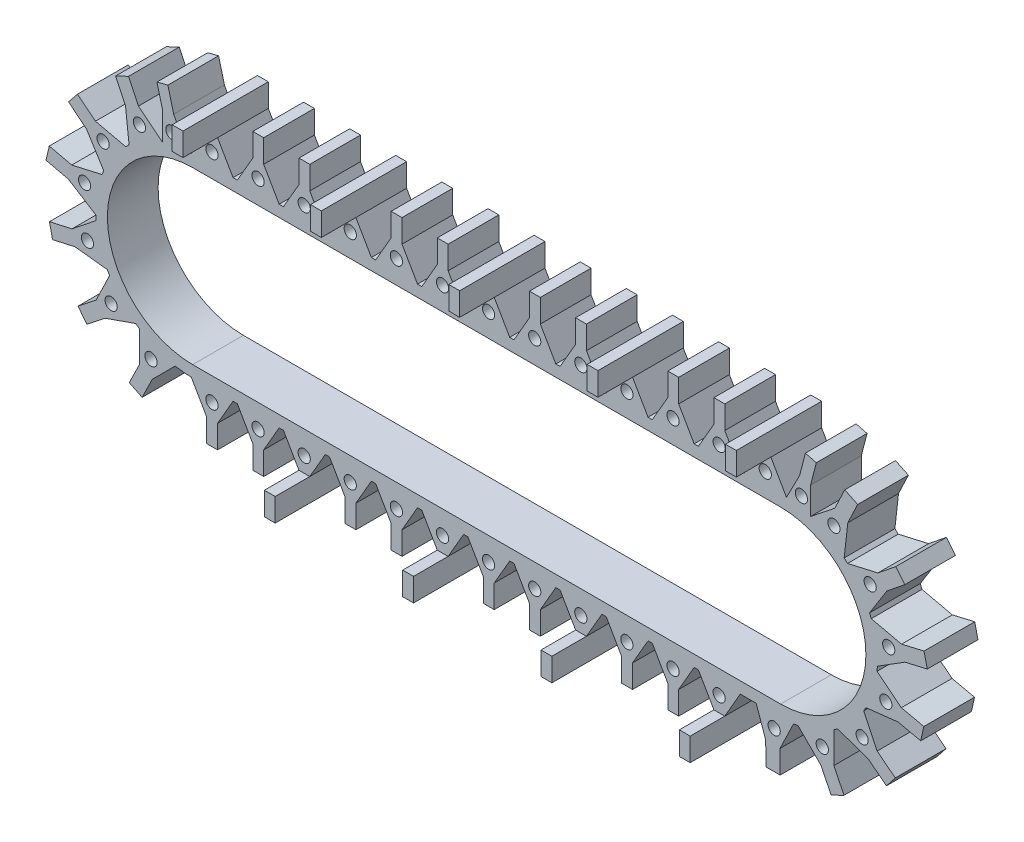
from build123d import *

# Parameters (mm, degrees)
SKETCH1_R                        = 5.304855617
BOSS_EXTRUDE1_DEPTH              = 44
SKIZZE1_W                        = 9.41415406
SKIZZE1_H                        = 44
AUFSATZ_LINEAR_AUSTRAGEN1_DEPTH  = 20
SKIZZE2_W                        = 9.41415406
SKIZZE2_H                        = 44
AUFSATZ_LINEAR_AUSTRAGEN2_DEPTH  = 20
SKIZZE3_W                        = 9.41415406
SKIZZE3_H                        = 44
AUFSATZ_LINEAR_AUSTRAGEN3_DEPTH  = 20
SKIZZE4_W                        = 9.41415406
SKIZZE4_H                        = 44
AUFSATZ_LINEAR_AUSTRAGEN4_DEPTH  = 20
SKIZZE5_W                        = 9.41415406
SKIZZE5_H                        = 44
AUFSATZ_LINEAR_AUSTRAGEN5_DEPTH  = 20
SKIZZE6_W                        = 9.41415406
SKIZZE6_H                        = 44
AUFSATZ_LINEAR_AUSTRAGEN6_DEPTH  = 20
SKIZZE7_W                        = 9.41415406
SKIZZE7_H                        = 44
AUFSATZ_LINEAR_AUSTRAGEN7_DEPTH  = 20
SKIZZE8_W                        = 9.41415406
SKIZZE8_H                        = 44
AUFSATZ_LINEAR_AUSTRAGEN8_DEPTH  = 20
SKIZZE9_W                        = 9.41415406
SKIZZE9_H                        = 44
AUFSATZ_LINEAR_AUSTRAGEN9_DEPTH  = 20
SKIZZE10_W                       = 9.41415406
SKIZZE10_H                       = 44
AUFSATZ_LINEAR_AUSTRAGEN10_DEPTH = 20
SKIZZE11_W                       = 9.41415406
SKIZZE11_H                       = 44
AUFSATZ_LINEAR_AUSTRAGEN11_DEPTH = 20
SKIZZE12_W                       = 9.803304207
SKIZZE12_H                       = 44
AUFSATZ_LINEAR_AUSTRAGEN12_DEPTH = 20
SKIZZE13_W                       = 12.432660884
SKIZZE13_H                       = 44
AUFSATZ_LINEAR_AUSTRAGEN13_DEPTH = 20
SKIZZE14_W                       = 44
SKIZZE14_H                       = 12.432660884
AUFSATZ_LINEAR_AUSTRAGEN14_DEPTH = 20
SKIZZE15_W                       = 44
SKIZZE15_H                       = 12.432660884
AUFSATZ_LINEAR_AUSTRAGEN15_DEPTH = 20
SKIZZE16_W                       = 44
SKIZZE16_H                       = 12.432660884
AUFSATZ_LINEAR_AUSTRAGEN16_DEPTH = 20
SKIZZE17_W                       = 44
SKIZZE17_H                       = 12.432660883
AUFSATZ_LINEAR_AUSTRAGEN17_DEPTH = 20
SKIZZE18_W                       = 12.432660884
SKIZZE18_H                       = 44
AUFSATZ_LINEAR_AUSTRAGEN18_DEPTH = 20
SKIZZE19_W                       = 9.41415406
SKIZZE19_H                       = 44
AUFSATZ_LINEAR_AUSTRAGEN19_DEPTH = 20
SKIZZE20_W                       = 9.41415406
SKIZZE20_H                       = 44
AUFSATZ_LINEAR_AUSTRAGEN20_DEPTH = 20
SKIZZE21_W                       = 9.41415406
SKIZZE21_H                       = 44
AUFSATZ_LINEAR_AUSTRAGEN21_DEPTH = 20
SKIZZE22_W                       = 9.41415406
SKIZZE22_H                       = 44
AUFSATZ_LINEAR_AUSTRAGEN22_DEPTH = 20
SKIZZE23_W                       = 9.41415406
SKIZZE23_H                       = 44
AUFSATZ_LINEAR_AUSTRAGEN23_DEPTH = 20
SKIZZE24_W                       = 9.41415406
SKIZZE24_H                       = 44
AUFSATZ_LINEAR_AUSTRAGEN24_DEPTH = 20
SKIZZE25_W                       = 9.41415406
SKIZZE25_H                       = 44
AUFSATZ_LINEAR_AUSTRAGEN25_DEPTH = 20
SKIZZE26_W                       = 9.41415406
SKIZZE26_H                       = 44
AUFSATZ_LINEAR_AUSTRAGEN26_DEPTH = 20
SKIZZE27_W                       = 9.41415406
SKIZZE27_H                       = 44
AUFSATZ_LINEAR_AUSTRAGEN27_DEPTH = 20
SKIZZE28_W                       = 9.41415406
SKIZZE28_H                       = 44
AUFSATZ_LINEAR_AUSTRAGEN28_DEPTH = 20
SKIZZE29_W                       = 9.41415406
SKIZZE29_H                       = 44
AUFSATZ_LINEAR_AUSTRAGEN29_DEPTH = 20
SKIZZE30_W                       = 9.41415406
SKIZZE30_H                       = 44
AUFSATZ_LINEAR_AUSTRAGEN30_DEPTH = 20
SKIZZE31_W                       = 12.432660883
SKIZZE31_H                       = 44
AUFSATZ_LINEAR_AUSTRAGEN31_DEPTH = 20
SKIZZE32_W                       = 12.432660883
SKIZZE32_H                       = 44
AUFSATZ_LINEAR_AUSTRAGEN32_DEPTH = 20
SKIZZE33_W                       = 44
SKIZZE33_H                       = 12.432660883
AUFSATZ_LINEAR_AUSTRAGEN33_DEPTH = 20
SKIZZE34_W                       = 44
SKIZZE34_H                       = 12.432660883
AUFSATZ_LINEAR_AUSTRAGEN34_DEPTH = 20
SKIZZE35_W                       = 44
SKIZZE35_H                       = 12.432660884
AUFSATZ_LINEAR_AUSTRAGEN35_DEPTH = 20
SKIZZE36_W                       = 44
SKIZZE36_H                       = 12.432660883
AUFSATZ_LINEAR_AUSTRAGEN36_DEPTH = 20
SKIZZE37_W                       = 12.432660883
SKIZZE37_H                       = 44
AUFSATZ_LINEAR_AUSTRAGEN37_DEPTH = 20
SKIZZE38_W                       = 9.803304207
SKIZZE38_H                       = 44
AUFSATZ_LINEAR_AUSTRAGEN38_DEPTH = 20
SKIZZE39_W                       = 9.41415406
SKIZZE39_H                       = 44
AUFSATZ_LINEAR_AUSTRAGEN39_DEPTH = 20
SKIZZE40_W                       = 9.41415406
SKIZZE40_H                       = 44
AUFSATZ_LINEAR_AUSTRAGEN40_DEPTH = 20
SKIZZE41_W                       = 9.41415406
SKIZZE41_H                       = 20
AUFSATZ_LINEAR_AUSTRAGEN41_DEPTH = 30


with BuildPart() as part:
    # Sketch1 → Boss-Extrude1 (new body)
    with BuildSketch(Plane.XY):
        with BuildLine():
            Line((-368.279008081, 208.137347398), (-377.693162141, 208.137347398))
            Line((-377.693162141, 208.137347398), (-391.140624551, 184.84565927))
            ThreePointArc((-391.140624551, 184.84565927), (-393.055558066, 184.794572872), (-394.968828688, 184.699832656))
            Line((-394.968828688, 184.699832656), (-406.364309987, 206.757674175))
            Line((-406.364309987, 206.757674175), (-415.856306602, 204.306802161))
            Line((-415.856306602, 204.306802161), (-415.856306602, 180.730933767))
            Line((-415.856306602, 180.730933767), (-436.937315979, 197.542477756))
            Line((-436.937315979, 197.542477756), (-448.168387597, 192.210115525))
            Line((-448.168387597, 192.210115525), (-445.013595724, 164.210563225))
            ThreePointArc((-445.013595724, 164.210563225), (-446.491708161, 162.892805497), (-447.938347028, 161.540571127))
            Line((-447.938347028, 161.540571127), (-474.225935747, 167.540541709))
            Line((-474.225935747, 167.540541709), (-482.031156365, 157.863269999))
            Line((-482.031156365, 157.863269999), (-467.040236656, 134.005357956))
            ThreePointArc((-467.040236656, 134.005357956), (-467.800216295, 132.176770316), (-468.516880373, 130.330776165))
            Line((-468.516880373, 130.330776165), (-494.804469092, 124.330805583))
            Line((-494.804469092, 124.330805583), (-497.637919041, 112.225326739))
            Line((-497.637919041, 112.225326739), (-473.780006998, 97.234407031))
            ThreePointArc((-473.780006998, 97.234407031), (-473.671330551, 95.257163688), (-473.516075729, 93.283031538))
            Line((-473.516075729, 93.283031538), (-494.597085106, 76.471487549))
            Line((-494.597085106, 76.471487549), (-491.897564874, 64.335440122))
            Line((-491.897564874, 64.335440122), (-463.898012575, 61.180648248))
            ThreePointArc((-463.898012575, 61.180648248), (-462.942204744, 59.446366495), (-461.945781144, 57.73509743))
            Line((-461.945781144, 57.73509743), (-473.644858731, 33.441712501))
            Line((-473.644858731, 33.441712501), (-465.947041408, 23.678789521))
            Line((-465.947041408, 23.678789521), (-439.351503576, 32.984970704))
            ThreePointArc((-439.351503576, 32.984970704), (-437.737873826, 31.837146312), (-436.097635362, 30.727678157))
            Line((-436.097635362, 30.727678157), (-436.097635362, 3.764055113))
            Line((-436.097635362, 3.764055113), (-424.926168076, -1.692076789))
            Line((-424.926168076, -1.692076789), (-405.002217154, 18.231874134))
            ThreePointArc((-405.002217154, 18.231874134), (-398.099796392, 17.260748368), (-391.140624551, 16.865242473))
            Line((-391.140624551, 16.865242473), (-377.693162141, -6.426445656))
            Line((-377.693162141, -6.426445656), (-368.279008081, -6.426445656))
            Line((-368.279008081, -6.426445656), (-354.837198854, 16.855450871))
            Line((-354.837198854, 16.855450871), (-351.134971368, 16.855450871))
            Line((-351.134971368, 16.855450871), (-337.693162141, -6.426445656))
            Line((-337.693162141, -6.426445656), (-328.279008081, -6.426445656))
            Line((-328.279008081, -6.426445656), (-314.837198854, 16.855450871))
            Line((-314.837198854, 16.855450871), (-311.134971368, 16.855450871))
            Line((-311.134971368, 16.855450871), (-297.693162141, -6.426445656))
            Line((-297.693162141, -6.426445656), (-288.279008081, -6.426445656))
            Line((-288.279008081, -6.426445656), (-274.837198854, 16.855450871))
            Line((-274.837198854, 16.855450871), (-271.134971368, 16.855450871))
            Line((-271.134971368, 16.855450871), (-257.693162141, -6.426445656))
            Line((-257.693162141, -6.426445656), (-248.279008081, -6.426445656))
            Line((-248.279008081, -6.426445656), (-234.837198854, 16.855450871))
            Line((-234.837198854, 16.855450871), (-231.134971368, 16.855450871))
            Line((-231.134971368, 16.855450871), (-217.693162141, -6.426445656))
            Line((-217.693162141, -6.426445656), (-208.279008081, -6.426445656))
            Line((-208.279008081, -6.426445656), (-194.837198854, 16.855450871))
            Line((-194.837198854, 16.855450871), (-191.134971368, 16.855450871))
            Line((-191.134971368, 16.855450871), (-177.693162141, -6.426445656))
            Line((-177.693162141, -6.426445656), (-168.279008081, -6.426445656))
            Line((-168.279008081, -6.426445656), (-154.837198854, 16.855450871))
            Line((-154.837198854, 16.855450871), (-151.134971368, 16.855450871))
            Line((-151.134971368, 16.855450871), (-137.693162141, -6.426445656))
            Line((-137.693162141, -6.426445656), (-128.279008081, -6.426445656))
            Line((-128.279008081, -6.426445656), (-114.837198854, 16.855450871))
            Line((-114.837198854, 16.855450871), (-111.134971368, 16.855450871))
            Line((-111.134971368, 16.855450871), (-97.693162141, -6.426445656))
            Line((-97.693162141, -6.426445656), (-88.279008081, -6.426445656))
            Line((-88.279008081, -6.426445656), (-74.837198854, 16.855450871))
            Line((-74.837198854, 16.855450871), (-71.134971368, 16.855450871))
            Line((-71.134971368, 16.855450871), (-57.693162141, -6.426445656))
            Line((-57.693162141, -6.426445656), (-48.279008081, -6.426445656))
            Line((-48.279008081, -6.426445656), (-34.837198854, 16.855450871))
            Line((-34.837198854, 16.855450871), (-31.134971368, 16.855450871))
            Line((-31.134971368, 16.855450871), (-17.693162141, -6.426445656))
            Line((-17.693162141, -6.426445656), (-8.279008081, -6.426445656))
            Line((-8.279008081, -6.426445656), (5.162801146, 16.855450871))
            Line((5.162801146, 16.855450871), (8.865028632, 16.855450871))
            Line((8.865028632, 16.855450871), (22.306837859, -6.426445656))
            Line((22.306837859, -6.426445656), (31.720991919, -6.426445656))
            Line((31.720991919, -6.426445656), (45.162801146, 16.855450871))
            Line((45.162801146, 16.855450871), (48.865028632, 16.855450871))
            Line((48.865028632, 16.855450871), (62.306837859, -6.426445656))
            Line((62.306837859, -6.426445656), (71.720991919, -6.426445656))
            Line((71.720991919, -6.426445656), (85.162801146, 16.855450871))
            Line((85.162801146, 16.855450871), (88.865028632, 16.855450871))
            Line((88.865028632, 16.855450871), (88.971712538, 16.855450871))
            Line((88.971712538, 16.855450871), (98.982794632, 16.855450871))
            Line((98.982794632, 16.855450871), (107.129482574, -6.426445656))
            Line((107.129482574, -6.426445656), (107.243450607, -6.752147583))
            Line((107.243450607, -6.752147583), (119.675921751, -6.683460598))
            Line((119.675921751, -6.683460598), (131.374999338, 17.60992433))
            ThreePointArc((131.374999338, 17.60992433), (133.334183321, 17.897847801), (135.28603583, 18.231874134))
            Line((135.28603583, 18.231874134), (155.209986752, -1.692076789))
            Line((155.209986752, -1.692076789), (166.381454038, 3.764055113))
            Line((166.381454038, 3.764055113), (166.381454038, 30.727678157))
            ThreePointArc((166.381454038, 30.727678157), (168.021692502, 31.837146312), (169.635322252, 32.984970704))
            Line((169.635322252, 32.984970704), (196.230860084, 23.678789521))
            Line((196.230860084, 23.678789521), (203.928677407, 33.441712501))
            Line((203.928677407, 33.441712501), (192.22959982, 57.73509743))
            ThreePointArc((192.22959982, 57.73509743), (193.22602342, 59.446366495), (194.181831251, 61.180648248))
            Line((194.181831251, 61.180648248), (222.18138355, 64.335440122))
            Line((222.18138355, 64.335440122), (224.880903782, 76.471487549))
            Line((224.880903782, 76.471487549), (203.799894405, 93.283031538))
            ThreePointArc((203.799894405, 93.283031538), (203.955149227, 95.257163688), (204.063825674, 97.234407031))
            Line((204.063825674, 97.234407031), (227.921737717, 112.225326739))
            Line((227.921737717, 112.225326739), (225.088287768, 124.330805583))
            Line((225.088287768, 124.330805583), (198.800699049, 130.330776165))
            ThreePointArc((198.800699049, 130.330776165), (198.084034971, 132.176770316), (197.324055332, 134.005357956))
            Line((197.324055332, 134.005357956), (212.314975041, 157.863269999))
            Line((212.314975041, 157.863269999), (204.509754423, 167.540541709))
            Line((204.509754423, 167.540541709), (178.222165704, 161.540571127))
            ThreePointArc((178.222165704, 161.540571127), (176.775526837, 162.892805497), (175.2974144, 164.210563225))
            Line((175.2974144, 164.210563225), (178.452206273, 192.210115525))
            Line((178.452206273, 192.210115525), (167.221134655, 197.542477756))
            Line((167.221134655, 197.542477756), (146.140125278, 180.730933767))
            Line((146.140125278, 180.730933767), (146.140125278, 204.306802161))
            Line((146.140125278, 204.306802161), (136.648128663, 206.757674175))
            Line((136.648128663, 206.757674175), (125.252647364, 184.699832656))
            Line((125.252647364, 184.699832656), (111.720991919, 208.137347398))
            Line((111.720991919, 208.137347398), (102.306837859, 208.137347398))
            Line((102.306837859, 208.137347398), (88.865028632, 184.855450871))
            Line((88.865028632, 184.855450871), (85.162801146, 184.855450871))
            Line((85.162801146, 184.855450871), (76.790181677, 199.357253183))
            Line((76.790181677, 199.357253183), (71.720991919, 208.137347398))
            Line((71.720991919, 208.137347398), (62.306837859, 208.137347398))
            Line((62.306837859, 208.137347398), (48.865028632, 184.855450871))
            Line((48.865028632, 184.855450871), (45.162801146, 184.855450871))
            Line((45.162801146, 184.855450871), (31.720991919, 208.137347398))
            Line((31.720991919, 208.137347398), (22.306837859, 208.137347398))
            Line((22.306837859, 208.137347398), (8.865028632, 184.855450871))
            Line((8.865028632, 184.855450871), (5.162801146, 184.855450871))
            Line((5.162801146, 184.855450871), (-8.279008081, 208.137347398))
            Line((-8.279008081, 208.137347398), (-17.693162141, 208.137347398))
            Line((-17.693162141, 208.137347398), (-31.134971368, 184.855450871))
            Line((-31.134971368, 184.855450871), (-34.837198854, 184.855450871))
            Line((-34.837198854, 184.855450871), (-48.279008081, 208.137347398))
            Line((-48.279008081, 208.137347398), (-57.693162141, 208.137347398))
            Line((-57.693162141, 208.137347398), (-71.134971368, 184.855450871))
            Line((-71.134971368, 184.855450871), (-74.837198854, 184.855450871))
            Line((-74.837198854, 184.855450871), (-88.279008081, 208.137347398))
            Line((-88.279008081, 208.137347398), (-97.693162141, 208.137347398))
            Line((-97.693162141, 208.137347398), (-111.134971368, 184.855450871))
            Line((-111.134971368, 184.855450871), (-114.837198854, 184.855450871))
            Line((-114.837198854, 184.855450871), (-128.279008081, 208.137347398))
            Line((-128.279008081, 208.137347398), (-137.693162141, 208.137347398))
            Line((-137.693162141, 208.137347398), (-151.134971368, 184.855450871))
            Line((-151.134971368, 184.855450871), (-154.837198854, 184.855450871))
            Line((-154.837198854, 184.855450871), (-168.279008081, 208.137347398))
            Line((-168.279008081, 208.137347398), (-177.693162141, 208.137347398))
            Line((-177.693162141, 208.137347398), (-191.134971368, 184.855450871))
            Line((-191.134971368, 184.855450871), (-194.837198854, 184.855450871))
            Line((-194.837198854, 184.855450871), (-208.279008081, 208.137347398))
            Line((-208.279008081, 208.137347398), (-217.693162141, 208.137347398))
            Line((-217.693162141, 208.137347398), (-231.134971368, 184.855450871))
            Line((-231.134971368, 184.855450871), (-234.837198854, 184.855450871))
            Line((-234.837198854, 184.855450871), (-248.279008081, 208.137347398))
            Line((-248.279008081, 208.137347398), (-257.693162141, 208.137347398))
            Line((-257.693162141, 208.137347398), (-271.134971368, 184.855450871))
            Line((-271.134971368, 184.855450871), (-274.837198854, 184.855450871))
            Line((-274.837198854, 184.855450871), (-288.279008081, 208.137347398))
            Line((-288.279008081, 208.137347398), (-297.693162141, 208.137347398))
            Line((-297.693162141, 208.137347398), (-311.134971368, 184.855450871))
            Line((-311.134971368, 184.855450871), (-314.837198854, 184.855450871))
            Line((-314.837198854, 184.855450871), (-328.279008081, 208.137347398))
            Line((-328.279008081, 208.137347398), (-337.693162141, 208.137347398))
            Line((-337.693162141, 208.137347398), (-351.134971368, 184.855450871))
            Line((-351.134971368, 184.855450871), (-354.837198854, 184.855450871))
            Line((-354.837198854, 184.855450871), (-368.279008081, 208.137347398))
        make_face()
        with Locations((-426.021067812, 12.909443776)):
            Circle(SKETCH1_R, mode=Mode.SUBTRACT)
        with Locations((-373.153370384, 6.777668426)):
            Circle(SKETCH1_R, mode=Mode.SUBTRACT)
        with Locations((-333.153370384, 6.777668426)):
            Circle(SKETCH1_R, mode=Mode.SUBTRACT)
        with Locations((-460.598149643, 37.309364166)):
            Circle(SKETCH1_R, mode=Mode.SUBTRACT)
        with Locations((-293.153370384, 6.777668426)):
            Circle(SKETCH1_R, mode=Mode.SUBTRACT)
        with Locations((-253.153370384, 6.777668426)):
            Circle(SKETCH1_R, mode=Mode.SUBTRACT)
        with Locations((-213.153370384, 6.777668426)):
            Circle(SKETCH1_R, mode=Mode.SUBTRACT)
        with Locations((-173.153370384, 6.777668426)):
            Circle(SKETCH1_R, mode=Mode.SUBTRACT)
        with Locations((-481.164295224, 74.295366369)):
            Circle(SKETCH1_R, mode=Mode.SUBTRACT)
        with Locations((-133.153370384, 6.777668426)):
            Circle(SKETCH1_R, mode=Mode.SUBTRACT)
        with Locations((-93.153370384, 6.777668426)):
            Circle(SKETCH1_R, mode=Mode.SUBTRACT)
        with Locations((-53.153370384, 6.777668426)):
            Circle(SKETCH1_R, mode=Mode.SUBTRACT)
        with Locations((-13.153370384, 6.777668426)):
            Circle(SKETCH1_R, mode=Mode.SUBTRACT)
        with Locations((26.846629616, 6.777668426)):
            Circle(SKETCH1_R, mode=Mode.SUBTRACT)
        with Locations((66.846629616, 6.777668426)):
            Circle(SKETCH1_R, mode=Mode.SUBTRACT)
        with Locations((156.304886488, 12.909443776)):
            Circle(SKETCH1_R, mode=Mode.SUBTRACT)
        with Locations((190.881968319, 37.309364166)):
            Circle(SKETCH1_R, mode=Mode.SUBTRACT)
        with Locations((211.4481139, 74.295366369)):
            Circle(SKETCH1_R, mode=Mode.SUBTRACT)
        with Locations((-483.646127194, 116.541919046)):
            Circle(SKETCH1_R, mode=Mode.SUBTRACT)
        with Locations((-467.552088294, 155.681574319)):
            Circle(SKETCH1_R, mode=Mode.SUBTRACT)
        with Locations((-436.069800308, 183.962243445)):
            Circle(SKETCH1_R, mode=Mode.SUBTRACT)
        with Locations((-407.896104995, 192.210115525)):
            Circle(SKETCH1_R, mode=Mode.SUBTRACT)
        with Locations((-373.153370384, 194.933233316)):
            Circle(SKETCH1_R, mode=Mode.SUBTRACT)
        with Locations((-333.153370384, 194.933233316)):
            Circle(SKETCH1_R, mode=Mode.SUBTRACT)
        with Locations((-293.153370384, 194.933233316)):
            Circle(SKETCH1_R, mode=Mode.SUBTRACT)
        with Locations((-253.153370384, 194.933233316)):
            Circle(SKETCH1_R, mode=Mode.SUBTRACT)
        with Locations((-213.153370384, 194.933233316)):
            Circle(SKETCH1_R, mode=Mode.SUBTRACT)
        with Locations((-173.153370384, 194.933233316)):
            Circle(SKETCH1_R, mode=Mode.SUBTRACT)
        with BuildLine():
            Line((-389.858090662, 174.855450871), (-134.858090662, 174.855450871))
            Line((-134.858090662, 174.855450871), (120.141909338, 174.855450871))
            ThreePointArc((120.141909338, 174.855450871), (194.141909338, 100.855450871), (120.141909338, 26.855450871))
            Line((120.141909338, 26.855450871), (-389.858090662, 26.855450871))
            ThreePointArc((-389.858090662, 26.855450871), (-463.858090662, 100.855450871), (-389.858090662, 174.855450871))
        make_face(mode=Mode.SUBTRACT)
        with Locations((213.92994587, 116.541919046)):
            Circle(SKETCH1_R, mode=Mode.SUBTRACT)
        with Locations((-133.153370384, 194.933233316)):
            Circle(SKETCH1_R, mode=Mode.SUBTRACT)
        with Locations((-93.153370384, 194.933233316)):
            Circle(SKETCH1_R, mode=Mode.SUBTRACT)
        with Locations((-53.153370384, 194.933233316)):
            Circle(SKETCH1_R, mode=Mode.SUBTRACT)
        with Locations((-13.153370384, 194.933233316)):
            Circle(SKETCH1_R, mode=Mode.SUBTRACT)
        with Locations((26.846629616, 194.933233316)):
            Circle(SKETCH1_R, mode=Mode.SUBTRACT)
        with Locations((197.83590697, 155.681574319)):
            Circle(SKETCH1_R, mode=Mode.SUBTRACT)
        with Locations((66.846629616, 194.933233316)):
            Circle(SKETCH1_R, mode=Mode.SUBTRACT)
        with Locations((106.846629616, 194.933233316)):
            Circle(SKETCH1_R, mode=Mode.SUBTRACT)
        with Locations((166.353618984, 183.962243445)):
            Circle(SKETCH1_R, mode=Mode.SUBTRACT)
        with Locations((138.179923671, 192.210115525)):
            Circle(SKETCH1_R, mode=Mode.SUBTRACT)
        with Locations((114.565283522, 5.928308679)):
            Circle(SKETCH1_R, mode=Mode.SUBTRACT)
    extrude(amount=BOSS_EXTRUDE1_DEPTH)

    # Skizze1 → Aufsatz-Linear austragen1 (add)
    with BuildSketch(Plane(origin=(0, 208.137347398, 0), x_dir=(1, 0, 0), z_dir=(0, 1, 0))):
        with Locations((27.013914889, -22)):
            Rectangle(SKIZZE1_W, SKIZZE1_H)
    extrude(amount=AUFSATZ_LINEAR_AUSTRAGEN1_DEPTH)

    # Skizze2 → Aufsatz-Linear austragen2 (add)
    with BuildSketch(Plane(origin=(0, 208.137347398, 0), x_dir=(1, 0, 0), z_dir=(0, 1, 0))):
        with Locations((-12.986085111, -22)):
            Rectangle(SKIZZE2_W, SKIZZE2_H)
    extrude(amount=AUFSATZ_LINEAR_AUSTRAGEN2_DEPTH)

    # Skizze3 → Aufsatz-Linear austragen3 (add)
    with BuildSketch(Plane(origin=(0, 208.137347398, 0), x_dir=(1, 0, 0), z_dir=(0, 1, 0))):
        with Locations((-52.986085111, -22)):
            Rectangle(SKIZZE3_W, SKIZZE3_H)
    extrude(amount=AUFSATZ_LINEAR_AUSTRAGEN3_DEPTH)

    # Skizze4 → Aufsatz-Linear austragen4 (add)
    with BuildSketch(Plane(origin=(0, 208.137347398, 0), x_dir=(1, 0, 0), z_dir=(0, 1, 0))):
        with Locations((-92.986085111, -22)):
            Rectangle(SKIZZE4_W, SKIZZE4_H)
    extrude(amount=AUFSATZ_LINEAR_AUSTRAGEN4_DEPTH)

    # Skizze5 → Aufsatz-Linear austragen5 (add)
    with BuildSketch(Plane(origin=(0, 208.137347398, 0), x_dir=(1, 0, 0), z_dir=(0, 1, 0))):
        with Locations((-132.986085111, -22)):
            Rectangle(SKIZZE5_W, SKIZZE5_H)
    extrude(amount=AUFSATZ_LINEAR_AUSTRAGEN5_DEPTH)

    # Skizze6 → Aufsatz-Linear austragen6 (add)
    with BuildSketch(Plane(origin=(0, 208.137347398, 0), x_dir=(1, 0, 0), z_dir=(0, 1, 0))):
        with Locations((-172.986085111, -22)):
            Rectangle(SKIZZE6_W, SKIZZE6_H)
    extrude(amount=AUFSATZ_LINEAR_AUSTRAGEN6_DEPTH)

    # Skizze7 → Aufsatz-Linear austragen7 (add)
    with BuildSketch(Plane(origin=(0, 208.137347398, 0), x_dir=(1, 0, 0), z_dir=(0, 1, 0))):
        with Locations((-212.986085111, -22)):
            Rectangle(SKIZZE7_W, SKIZZE7_H)
    extrude(amount=AUFSATZ_LINEAR_AUSTRAGEN7_DEPTH)

    # Skizze8 → Aufsatz-Linear austragen8 (add)
    with BuildSketch(Plane(origin=(0, 208.137347398, 0), x_dir=(1, 0, 0), z_dir=(0, 1, 0))):
        with Locations((-252.986085111, -22)):
            Rectangle(SKIZZE8_W, SKIZZE8_H)
    extrude(amount=AUFSATZ_LINEAR_AUSTRAGEN8_DEPTH)

    # Skizze9 → Aufsatz-Linear austragen9 (add)
    with BuildSketch(Plane(origin=(0, 208.137347398, 0), x_dir=(1, 0, 0), z_dir=(0, 1, 0))):
        with Locations((-292.986085111, -22)):
            Rectangle(SKIZZE9_W, SKIZZE9_H)
    extrude(amount=AUFSATZ_LINEAR_AUSTRAGEN9_DEPTH)

    # Skizze10 → Aufsatz-Linear austragen10 (add)
    with BuildSketch(Plane(origin=(0, 208.137347398, 0), x_dir=(1, 0, 0), z_dir=(0, 1, 0))):
        with Locations((-332.986085111, -22)):
            Rectangle(SKIZZE10_W, SKIZZE10_H)
    extrude(amount=AUFSATZ_LINEAR_AUSTRAGEN10_DEPTH)

    # Skizze11 → Aufsatz-Linear austragen11 (add)
    with BuildSketch(Plane(origin=(0, 208.137347398, 0), x_dir=(1, 0, 0), z_dir=(0, 1, 0))):
        with Locations((-372.986085111, -22)):
            Rectangle(SKIZZE11_W, SKIZZE11_H)
    extrude(amount=AUFSATZ_LINEAR_AUSTRAGEN11_DEPTH)

    # Skizze12 → Aufsatz-Linear austragen12 (add)
    with BuildSketch(Plane(origin=(-75.447662284, 292.201694384, 0), x_dir=(0.9682446260031685, 0.25000468838800677, 0), z_dir=(-0.25000468838800677, 0.9682446260031685, 0))):
        with Locations((-346.671323544, -22)):
            Rectangle(SKIZZE12_W, SKIZZE12_H)
    extrude(amount=AUFSATZ_LINEAR_AUSTRAGEN12_DEPTH)

    # Skizze13 → Aufsatz-Linear austragen13 (add)
    with BuildSketch(Plane(origin=(-156.91401837, 330.493785245, 0), x_dir=(0.903352204551377, 0.4288995156585833, 0), z_dir=(-0.4288995156585833, 0.903352204551377, 0))):
        with Locations((-316.198745051, -22)):
            Rectangle(SKIZZE13_W, SKIZZE13_H)
    extrude(amount=AUFSATZ_LINEAR_AUSTRAGEN13_DEPTH)

    # Skizze14 → Aufsatz-Linear austragen14 (add)
    with BuildSketch(Plane(origin=(-369.189062207, 297.770091225, 0), x_dir=(0, 0, 1), z_dir=(-0.778374943317651, 0.6277996874921519, 0))):
        with Locations((22, -173.525865048)):
            Rectangle(SKIZZE14_W, SKIZZE14_H)
    extrude(amount=AUFSATZ_LINEAR_AUSTRAGEN14_DEPTH)

    # Skizze15 → Aufsatz-Linear austragen15 (add)
    with BuildSketch(Plane(origin=(-496.694038224, 116.257912268, 0), x_dir=(0, 0, 1), z_dir=(-0.9736836673104443, 0.2279037428672114, 0))):
        with Locations((22, 2.074753804)):
            Rectangle(SKIZZE15_W, SKIZZE15_H)
    extrude(amount=AUFSATZ_LINEAR_AUSTRAGEN15_DEPTH)

    # Skizze16 → Aufsatz-Linear austragen16 (add)
    with BuildSketch(Plane(origin=(-455.07058717, -101.22507053, 0), x_dir=(0, 0, 1), z_dir=(-0.9761423995458788, -0.21713133308855742, 0))):
        with Locations((22, 175.823255342)):
            Rectangle(SKIZZE16_W, SKIZZE16_H)
    extrude(amount=AUFSATZ_LINEAR_AUSTRAGEN16_DEPTH)

    # Skizze17 → Aufsatz-Linear austragen17 (add)
    with BuildSketch(Plane(origin=(-275.808747039, -217.468206514, 0), x_dir=(0, 0, 1), z_dir=(-0.7852641579503548, -0.619160885585096, 0))):
        with Locations((22, 313.306617951)):
            Rectangle(SKIZZE17_W, SKIZZE17_H)
    extrude(amount=AUFSATZ_LINEAR_AUSTRAGEN17_DEPTH)

    # Skizze18 → Aufsatz-Linear austragen18 (add)
    with BuildSketch(Plane(origin=(-82.505250433, -168.930063051, 0), x_dir=(0.8985580311815659, -0.43885471923987357, 0), z_dir=(-0.4388547192398735, -0.8985580311815657, 0))):
        with Locations((-387.294575542, 22)):
            Rectangle(SKIZZE18_W, SKIZZE18_H)
    extrude(amount=AUFSATZ_LINEAR_AUSTRAGEN18_DEPTH)

    # Skizze19 → Aufsatz-Linear austragen19 (add)
    with BuildSketch(Plane.XZ.offset(6.426445656)):
        with Locations((-372.986085111, 22)):
            Rectangle(SKIZZE19_W, SKIZZE19_H)
    extrude(amount=AUFSATZ_LINEAR_AUSTRAGEN19_DEPTH)

    # Skizze20 → Aufsatz-Linear austragen20 (add)
    with BuildSketch(Plane.XZ.offset(6.426445656)):
        with Locations((-332.986085111, 22)):
            Rectangle(SKIZZE20_W, SKIZZE20_H)
    extrude(amount=AUFSATZ_LINEAR_AUSTRAGEN20_DEPTH)

    # Skizze21 → Aufsatz-Linear austragen21 (add)
    with BuildSketch(Plane.XZ.offset(6.426445656)):
        with Locations((-292.986085111, 22)):
            Rectangle(SKIZZE21_W, SKIZZE21_H)
    extrude(amount=AUFSATZ_LINEAR_AUSTRAGEN21_DEPTH)

    # Skizze22 → Aufsatz-Linear austragen22 (add)
    with BuildSketch(Plane.XZ.offset(6.426445656)):
        with Locations((-252.986085111, 22)):
            Rectangle(SKIZZE22_W, SKIZZE22_H)
    extrude(amount=AUFSATZ_LINEAR_AUSTRAGEN22_DEPTH)

    # Skizze23 → Aufsatz-Linear austragen23 (add)
    with BuildSketch(Plane.XZ.offset(6.426445656)):
        with Locations((-212.986085111, 22)):
            Rectangle(SKIZZE23_W, SKIZZE23_H)
    extrude(amount=AUFSATZ_LINEAR_AUSTRAGEN23_DEPTH)

    # Skizze24 → Aufsatz-Linear austragen24 (add)
    with BuildSketch(Plane.XZ.offset(6.426445656)):
        with Locations((-172.986085111, 22)):
            Rectangle(SKIZZE24_W, SKIZZE24_H)
    extrude(amount=AUFSATZ_LINEAR_AUSTRAGEN24_DEPTH)

    # Skizze25 → Aufsatz-Linear austragen25 (add)
    with BuildSketch(Plane.XZ.offset(6.426445656)):
        with Locations((-132.986085111, 22)):
            Rectangle(SKIZZE25_W, SKIZZE25_H)
    extrude(amount=AUFSATZ_LINEAR_AUSTRAGEN25_DEPTH)

    # Skizze26 → Aufsatz-Linear austragen26 (add)
    with BuildSketch(Plane.XZ.offset(6.426445656)):
        with Locations((-92.986085111, 22)):
            Rectangle(SKIZZE26_W, SKIZZE26_H)
    extrude(amount=AUFSATZ_LINEAR_AUSTRAGEN26_DEPTH)

    # Skizze27 → Aufsatz-Linear austragen27 (add)
    with BuildSketch(Plane.XZ.offset(6.426445656)):
        with Locations((-52.986085111, 22)):
            Rectangle(SKIZZE27_W, SKIZZE27_H)
    extrude(amount=AUFSATZ_LINEAR_AUSTRAGEN27_DEPTH)

    # Skizze28 → Aufsatz-Linear austragen28 (add)
    with BuildSketch(Plane.XZ.offset(6.426445656)):
        with Locations((-12.986085111, 22)):
            Rectangle(SKIZZE28_W, SKIZZE28_H)
    extrude(amount=AUFSATZ_LINEAR_AUSTRAGEN28_DEPTH)

    # Skizze29 → Aufsatz-Linear austragen29 (add)
    with BuildSketch(Plane.XZ.offset(6.426445656)):
        with Locations((27.013914889, 22)):
            Rectangle(SKIZZE29_W, SKIZZE29_H)
    extrude(amount=AUFSATZ_LINEAR_AUSTRAGEN29_DEPTH)

    # Skizze30 → Aufsatz-Linear austragen30 (add)
    with BuildSketch(Plane.XZ.offset(6.426445656)):
        with Locations((67.013914889, 22)):
            Rectangle(SKIZZE30_W, SKIZZE30_H)
    extrude(amount=AUFSATZ_LINEAR_AUSTRAGEN30_DEPTH)

    # Skizze31 → Aufsatz-Linear austragen31 (add)
    with BuildSketch(Plane(origin=(0.040576506, -7.344422612, 0), x_dir=(0.9999847386114645, 0.00552472118401051, 0), z_dir=(0.00552472118401051, -0.9999847386114645, 0))):
        with Locations((113.420840633, 22)):
            Rectangle(SKIZZE31_W, SKIZZE31_H)
    extrude(amount=AUFSATZ_LINEAR_AUSTRAGEN31_DEPTH)

    # Skizze32 → Aufsatz-Linear austragen32 (add)
    with BuildSketch(Plane(origin=(30.559676613, -62.571146321, 0), x_dir=(0.8985580311815659, 0.43885471923987357, 0), z_dir=(0.4388547192398735, -0.8985580311815657, 0))):
        with Locations((144.938934674, 22)):
            Rectangle(SKIZZE32_W, SKIZZE32_H)
    extrude(amount=AUFSATZ_LINEAR_AUSTRAGEN32_DEPTH)

    # Skizze33 → Aufsatz-Linear austragen33 (add)
    with BuildSketch(Plane(origin=(109.491015535, -86.330890638, 0), x_dir=(0, 0, -1), z_dir=(0.7852641579503548, -0.619160885585096, 0))):
        with Locations((-22, 146.308908266)):
            Rectangle(SKIZZE33_W, SKIZZE33_H)
    extrude(amount=AUFSATZ_LINEAR_AUSTRAGEN33_DEPTH)

    # Skizze34 → Aufsatz-Linear austragen34 (add)
    with BuildSketch(Plane(origin=(198.070449194, -44.058429077, 0), x_dir=(0, 0, -1), z_dir=(0.9761423995458783, -0.21713133308855892, 0))):
        with Locations((-22, 117.259421336)):
            Rectangle(SKIZZE34_W, SKIZZE34_H)
    extrude(amount=AUFSATZ_LINEAR_AUSTRAGEN34_DEPTH)

    # Skizze35 → Aufsatz-Linear austragen35 (add)
    with BuildSketch(Plane(origin=(240.986946649, 56.406232298, 0), x_dir=(0, 0, -1), z_dir=(0.973683667310444, 0.22790374286721302, 0))):
        with Locations((-22, 63.54408104)):
            Rectangle(SKIZZE35_W, SKIZZE35_H)
    extrude(amount=AUFSATZ_LINEAR_AUSTRAGEN35_DEPTH)

    # Skizze36 → Aufsatz-Linear austragen36 (add)
    with BuildSketch(Plane(origin=(205.77677959, 165.969625601, 0), x_dir=(0, 0, -1), z_dir=(0.7783749433176502, 0.6277996874921529, 0))):
        with Locations((-22, -4.198130702)):
            Rectangle(SKIZZE36_W, SKIZZE36_H)
    extrude(amount=AUFSATZ_LINEAR_AUSTRAGEN36_DEPTH)

    # Skizze37 → Aufsatz-Linear austragen37 (add)
    with BuildSketch(Plane(origin=(107.298433653, 225.992972821, 0), x_dir=(0.9033522045513767, -0.4288995156585839, 0), z_dir=(0.4288995156585839, 0.9033522045513767, 0))):
        with Locations((72.550038048, -22)):
            Rectangle(SKIZZE37_W, SKIZZE37_H)
    extrude(amount=AUFSATZ_LINEAR_AUSTRAGEN37_DEPTH)

    # Skizze38 → Aufsatz-Linear austragen38 (add)
    with BuildSketch(Plane(origin=(58.589768678, 226.912659227, 0), x_dir=(0.9682446260031683, -0.25000468838800755, 0), z_dir=(0.25000468838800755, 0.9682446260031684, 0))):
        with Locations((85.520080431, -22)):
            Rectangle(SKIZZE38_W, SKIZZE38_H)
    extrude(amount=AUFSATZ_LINEAR_AUSTRAGEN38_DEPTH)

    # Skizze39 → Aufsatz-Linear austragen39 (add)
    with BuildSketch(Plane(origin=(0, 208.137347398, 0), x_dir=(1, 0, 0), z_dir=(0, 1, 0))):
        with Locations((107.013914889, -22)):
            Rectangle(SKIZZE39_W, SKIZZE39_H)
    extrude(amount=AUFSATZ_LINEAR_AUSTRAGEN39_DEPTH)

    # Skizze40 → Aufsatz-Linear austragen40 (add)
    with BuildSketch(Plane(origin=(0, 208.137347398, 0), x_dir=(1, 0, 0), z_dir=(0, 1, 0))):
        with Locations((67.013914889, -22)):
            Rectangle(SKIZZE40_W, SKIZZE40_H)
    extrude(amount=AUFSATZ_LINEAR_AUSTRAGEN40_DEPTH)

    # Skizze41 → Aufsatz-Linear austragen41 (add)
    with BuildSketch(Plane.XY.offset(44)):
        with Locations((-372.986085111, 218.137347398)):
            Rectangle(SKIZZE41_W, SKIZZE41_H)
        with Locations((-252.986085111, 218.137347398)):
            Rectangle(SKIZZE41_W, SKIZZE41_H)
        with Locations((-132.986085111, 218.137347398)):
            Rectangle(SKIZZE41_W, SKIZZE41_H)
        with Locations((-12.986085111, 218.137347398)):
            Rectangle(SKIZZE41_W, SKIZZE41_H)
        with Locations((107.013914889, 218.137347398)):
            Rectangle(SKIZZE41_W, SKIZZE41_H)
        with Locations((67.013914889, -16.426445656)):
            Rectangle(SKIZZE41_W, SKIZZE41_H)
        with Locations((-52.986085111, -16.426445656)):
            Rectangle(SKIZZE41_W, SKIZZE41_H)
        with Locations((-172.986085111, -16.426445656)):
            Rectangle(SKIZZE41_W, SKIZZE41_H)
        with Locations((-292.986085111, -16.426445656)):
            Rectangle(SKIZZE41_W, SKIZZE41_H)
    extrude(amount=AUFSATZ_LINEAR_AUSTRAGEN41_DEPTH)


solid = part.part
